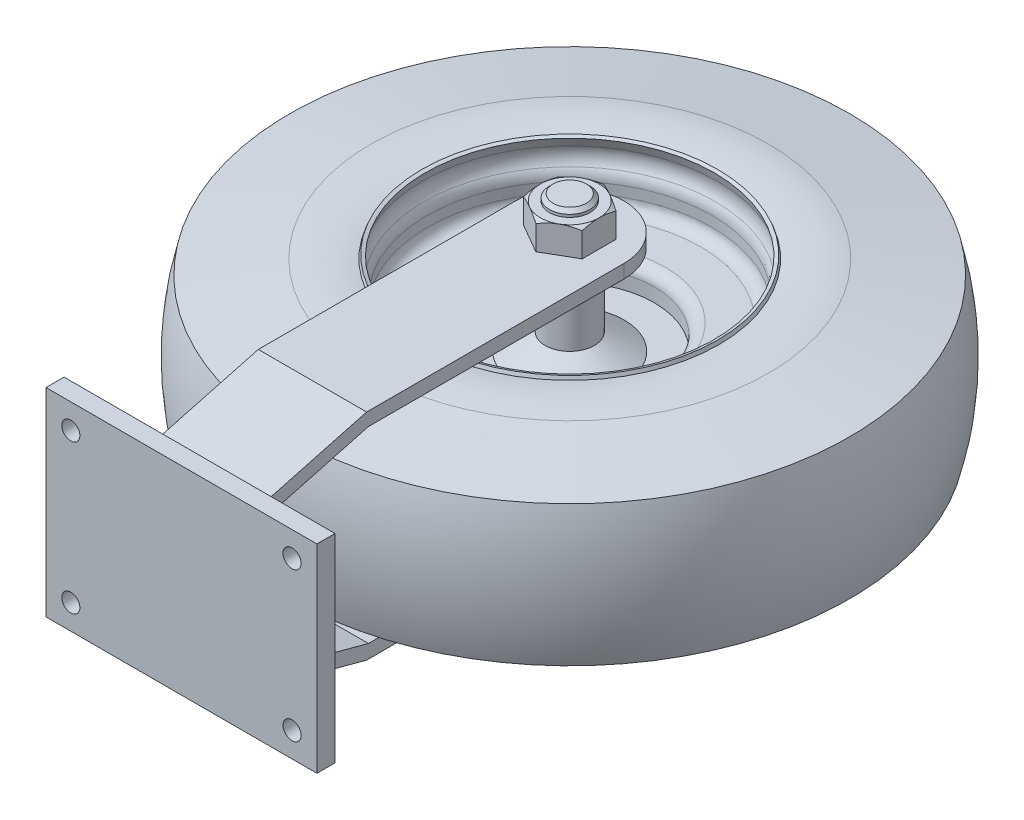
from build123d import *

# Parameters (mm, degrees)
SKETCH2_W           = 190.5
SKETCH2_H           = 139.7
SKETCH2_R           = 6.35
PLATE_2_DEPTH       = 12.7
BOSS_EXTRUDE3_DEPTH = 75.565
CUT_EXTRUDE1_DEPTH  = 107.95
SKETCH12_W          = 190.5
SKETCH12_H          = 12.7
CUT_EXTRUDE4_DEPTH  = 357.416059157
SKETCH13_W          = 190.5
SKETCH13_H          = 12.7
CUT_EXTRUDE5_DEPTH  = 357.416059157
SKETCH6_R           = 14.2875
BOSS_EXTRUDE5_DEPTH = 99.06
CHAMFER2_SIZE       = 2.54
BOSS_EXTRUDE7_DEPTH = 19.05
SKETCH11_OUTSIDE_W  = 1590.774
SKETCH11_OUTSIDE_H  = 1711.424
SKETCH11_OUTSIDE_R  = 20.6375
CUT_EXTRUDE3_DEPTH  = 379.67781903
CUT_EXTRUDE3_DRAFT  = -60


with BuildPart() as part:
    # Sketch2 → Plate 2 (new body)
    with BuildSketch(Plane.XY):
        Rectangle(SKETCH2_W, SKETCH2_H)
        with Locations((-77.7875, 52.3875)):
            Circle(SKETCH2_R, mode=Mode.SUBTRACT)
        with Locations((-77.7875, -52.3875)):
            Circle(SKETCH2_R, mode=Mode.SUBTRACT)
        with Locations((77.7875, -52.3875)):
            Circle(SKETCH2_R, mode=Mode.SUBTRACT)
        with Locations((77.7875, 52.3875)):
            Circle(SKETCH2_R, mode=Mode.SUBTRACT)
    extrude(amount=-PLATE_2_DEPTH)

    # Sketch3 → Boss-Extrude3 (add, symmetric)
    with BuildSketch(Plane(origin=(0, 0, 0), x_dir=(1, 0, 0), z_dir=(0, 1, 0))):
        with BuildLine():
            Line((-38.1, 0), (38.1, 0))
            Line((38.1, 0), (38.1, 273.05))
            ThreePointArc((38.1, 273.05), (0, 311.15), (-38.1, 273.05))
            Line((-38.1, 273.05), (-38.1, 0))
        make_face()
    extrude(amount=BOSS_EXTRUDE3_DEPTH, both=True)

    # Sketch4 → Cut-Extrude1 (cut)
    with BuildSketch(Plane(origin=(38.1, 0, 0), x_dir=(0, 0, -1), z_dir=(1, 0, 0))):
        Polygon((93.377733092, 66.04), (311.15, 66.04), (311.15, -66.04), (93.377733092, -66.04), (12.7, -44.422466571), (12.7, 44.422466571), align=None)
        Polygon((12.7, 54.283472189), (92.123743052, 75.565), (12.7, 75.565), align=None)
        Polygon((12.7, -75.565), (92.123743052, -75.565), (12.7, -54.283472189), align=None)
    extrude(amount=-CUT_EXTRUDE1_DEPTH, mode=Mode.SUBTRACT)

    # Sketch12 → Cut-Extrude4 (cut, through all)
    with BuildSketch(Plane(origin=(0, 69.85, 0), x_dir=(1, 0, 0), z_dir=(0, 1, 0))):
        with Locations((0, 6.35)):
            Rectangle(SKETCH12_W, SKETCH12_H)
    extrude(amount=CUT_EXTRUDE4_DEPTH, mode=Mode.SUBTRACT)

    # Sketch13 → Cut-Extrude5 (cut, through all)
    with BuildSketch(Plane.XZ.offset(69.85)):
        with Locations((0, -6.35)):
            Rectangle(SKETCH13_W, SKETCH13_H)
    extrude(amount=CUT_EXTRUDE5_DEPTH, mode=Mode.SUBTRACT)

    # Sketch6 → Boss-Extrude5 (add, symmetric)
    with BuildSketch(Plane(origin=(0, 0, 0), x_dir=(1, 0, 0), z_dir=(0, 1, 0))):
        with Locations(Location((0, 273.05, 0), (0, 0, 270))):
            Circle(SKETCH6_R)
    extrude(amount=BOSS_EXTRUDE5_DEPTH, both=True)

    # Chamfer2
    chamfer2_edges = [part.edges().sort_by_distance(p)[0] for p in [
        (0, -99.06, -287.3375),
        (0, 99.06, -287.3375),
    ]]
    chamfer(chamfer2_edges, length=CHAMFER2_SIZE)


with BuildPart() as body_2:
    # Sketch9 → Boss-Extrude7 (new body)
    with BuildSketch(Plane(origin=(0, -75.565, 0), x_dir=(-1, 0, 0), z_dir=(0, 1, 0))):
        Polygon((0, -249.219867639), (-20.6375, -261.13493382), (-20.6375, -284.96506618), (0, -296.880132361), (20.6375, -284.96506618), (20.6375, -261.13493382), align=None)
    extrude(amount=-BOSS_EXTRUDE7_DEPTH)


with BuildPart() as cut_extrude3_tool:
    # Sketch11 outside → Cut-Extrude3 (with draft: the straight prism first)
    with BuildSketch(Plane.XZ.offset(94.615)):
        with Locations((0, -155.575)):
            Rectangle(SKETCH11_OUTSIDE_W, SKETCH11_OUTSIDE_H)
        with Locations((0, -273.05)):
            Circle(SKETCH11_OUTSIDE_R, mode=Mode.SUBTRACT)
    extrude(amount=-CUT_EXTRUDE3_DEPTH)
    # Cut-Extrude3: the draft: its side faces are tilted about the plane it starts from
    cut_extrude3_sides = [cut_extrude3_tool.faces().sort_by_distance(p)[0] for p in [
        (0, 95.223909515, -1011.287),
        (795.387, 95.223909515, -155.575),
        (0, 95.223909515, 700.137),
        (-795.387, 95.223909515, -155.575),
        (-20.6375, 95.223909515, -273.05),
    ]]
    draft(cut_extrude3_sides, Plane.XZ.offset(94.615), CUT_EXTRUDE3_DRAFT)


with BuildPart() as body_2_1:
    add(body_2.part)

    # Cut-Extrude3: cut by cut_extrude3_tool
    add(cut_extrude3_tool.part, mode=Mode.SUBTRACT)


with BuildPart() as body_3:
    # Mirror5: mirrored copy
    add(body_2_1.part.mirror(Plane.ZX))


with BuildPart() as body_2_2:
    add(body_2_1.part)

    # Combine1: union body 3, part
    add(body_3.part)
    add(part.part)


with BuildPart() as body_2_2_1:
    # Sketch8 → Revolve1 (revolve)
    with BuildSketch(Plane(origin=(0, 0, 0), x_dir=(0, 0, -1), z_dir=(1, 0, 0)), mode=Mode.PRIVATE) as revolve1_sk:
        with BuildLine():
            Line((273.05, -60.96), (255.8415, -60.96))
            Line((255.8415, -60.96), (255.8415, -15.101863811))
            Line((255.8415, -15.101863811), (234.743625, -2.921))
            Line((234.743625, -2.921), (213.64575, -2.921))
            Line((213.64575, -2.921), (213.64575, -12.594166667))
            ThreePointArc((213.64575, -12.594166667), (211.320910076, -18.206826742), (205.70825, -20.531666667))
            Line((205.70825, -20.531666667), (180.885365786, -20.531666667))
            ThreePointArc((180.885365786, -20.531666667), (175.27270571, -22.856506591), (172.947865786, -28.469166667))
            Line((172.947865786, -28.469166667), (172.947865786, -35.724041667))
            ThreePointArc((172.947865786, -35.724041667), (172.362503087, -39.535283335), (170.660375541, -42.995192923))
            ThreePointArc((170.660375541, -42.995192923), (168.480481387, -48.616688527), (169.138789012, -54.61))
            Line((169.138789012, -54.61), (171.45, -60.96))
            Line((171.45, -60.96), (169.063180743, -61.828731164))
            Line((169.063180743, -61.828731164), (168.192297821, -59.436))
            ThreePointArc((168.192297821, -59.436), (150.772898111, -60.96), (133.353498402, -59.436))
            Line((133.353498402, -59.436), (76.2, -49.35829619))
            ThreePointArc((76.2, -49.35829619), (69.85, 0), (76.2, 49.35829619))
            Line((76.2, 49.35829619), (133.353498402, 59.436))
            ThreePointArc((133.353498402, 59.436), (150.772898111, 60.96), (168.192297821, 59.436))
            Line((168.192297821, 59.436), (169.063180743, 61.828731164))
            Line((169.063180743, 61.828731164), (171.45, 60.96))
            Line((171.45, 60.96), (169.138789012, 54.61))
            ThreePointArc((169.138789012, 54.61), (168.480481387, 48.616688527), (170.660375541, 42.995192923))
            ThreePointArc((170.660375541, 42.995192923), (172.362503087, 39.535283335), (172.947865786, 35.724041667))
            Line((172.947865786, 35.724041667), (172.947865786, 28.469166667))
            ThreePointArc((172.947865786, 28.469166667), (175.27270571, 22.856506591), (180.885365786, 20.531666667))
            Line((180.885365786, 20.531666667), (205.70825, 20.531666667))
            ThreePointArc((205.70825, 20.531666667), (211.320910076, 18.206826742), (213.64575, 12.594166667))
            Line((213.64575, 12.594166667), (213.64575, 2.921))
            Line((213.64575, 2.921), (234.743625, 2.921))
            Line((234.743625, 2.921), (255.8415, 15.101863811))
            Line((255.8415, 15.101863811), (255.8415, 60.96))
            Line((255.8415, 60.96), (273.05, 60.96))
            Line((273.05, 60.96), (273.05, -60.96))
        make_face()
    revolve(revolve1_sk.sketch.rotate(Axis((0, -60.96, -273.05), (0, 1, 0)), 180), axis=Axis((0, -60.96, -273.05), (0, 1, 0)))


solid = Compound([body_2_2.part, body_2_2_1.part])
